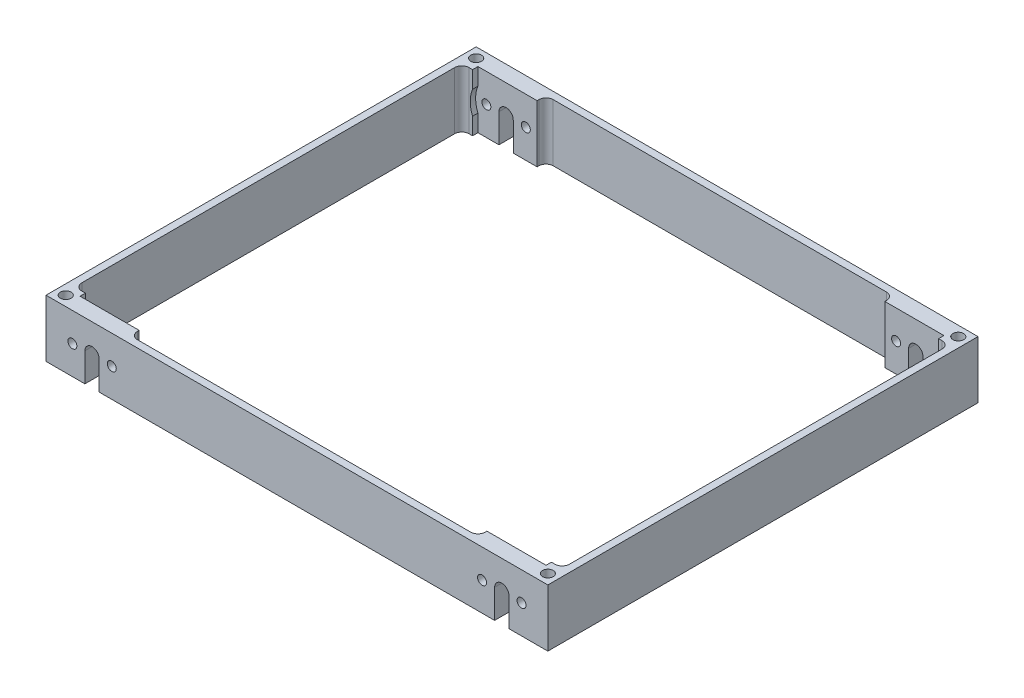
from build123d import *

# Parameters (mm, degrees)
SKETCH1_W           = 140
SKETCH1_H           = 120
SKETCH1_W_2         = 131
SKETCH1_H_2         = 111
BOSS_EXTRUDE1_DEPTH = 16
CUT_EXTRUDE1_DEPTH  = 186.08376482
SKETCH5_R           = 1.25
CUT_EXTRUDE3_DEPTH  = 186.08376482
CUT_EXTRUDE2_DEPTH  = 186.08376482
BOSS_EXTRUDE2_DEPTH = 115.5
SKETCH7_W           = 136
SKETCH7_H           = 108
CUT_EXTRUDE4_DEPTH  = 186.08376482
FILLET1_R           = 2
SKETCH9_R           = 1.3
CUT_EXTRUDE5_DEPTH  = 4
SKETCH10_R          = 1.5
CUT_EXTRUDE6_DEPTH  = 186.08376482


with BuildPart() as part:
    # Sketch1 → Boss-Extrude1 (new body)
    with BuildSketch(Plane(origin=(0, 0, 0), x_dir=(1, 0, 0), z_dir=(0, 1, 0))):
        with Locations((-70, 60)):
            Rectangle(SKETCH1_W, SKETCH1_H)
        with Locations((-70, 60)):
            Rectangle(SKETCH1_W_2, SKETCH1_H_2, mode=Mode.SUBTRACT)
    extrude(amount=BOSS_EXTRUDE1_DEPTH)

    # Sketch3 → Cut-Extrude1 (cut, through all)
    with BuildSketch(Plane.XY):
        with BuildLine():
            Line((-129.15, 8), (-129.15, 0))
            Line((-129.15, 0), (-125.15, 0))
            Line((-125.15, 0), (-125.15, 8))
            ThreePointArc((-125.15, 8), (-127.15, 10), (-129.15, 8))
        make_face()
        with BuildLine():
            Line((-14.85, 8), (-14.85, 0))
            Line((-14.85, 0), (-10.85, 0))
            Line((-10.85, 0), (-10.85, 8))
            ThreePointArc((-10.85, 8), (-12.85, 10), (-14.85, 8))
        make_face()
    extrude(amount=-CUT_EXTRUDE1_DEPTH, mode=Mode.SUBTRACT)

    # Sketch5 → Cut-Extrude3 (cut, through all)
    with BuildSketch(Plane.XY):
        with Locations((-132.65, 8)):
            Circle(SKETCH5_R)
        with Locations((-121.65, 8)):
            Circle(SKETCH5_R)
        with Locations((-18.35, 8)):
            Circle(SKETCH5_R)
        with Locations((-7.35, 8)):
            Circle(SKETCH5_R)
    extrude(amount=-CUT_EXTRUDE3_DEPTH, mode=Mode.SUBTRACT)

    # Sketch4 → Cut-Extrude2 (cut, through all)
    with BuildSketch(Plane(origin=(0, 16, 0), x_dir=(1, 0, 0), z_dir=(0, 1, 0))):
        Polygon((-138, 115.5), (-118.5, 115.5), (-118.5, 118), (-21.5, 118), (-21.5, 115.5), (-2, 115.5), (-2, 4.5), (-21.5, 4.5), (-21.5, 2), (-118.5, 2), (-118.5, 4.5), (-138, 4.5), align=None)
    extrude(amount=-CUT_EXTRUDE2_DEPTH, mode=Mode.SUBTRACT)

    # Sketch6 → Boss-Extrude2 (add)
    with BuildSketch(Plane.XY):
        with BuildLine():
            Line((-140, 16), (-135, 16))
            Line((-135, 16), (-135, 11.259984663))
            ThreePointArc((-135, 11.259984663), (-135.65, 8), (-135, 4.740015337))
            Line((-135, 4.740015337), (-135, 0))
            Line((-135, 0), (-140, 0))
            Line((-140, 0), (-140, 16))
        make_face()
        with BuildLine():
            Line((-5, 16), (-5, 11.259984663))
            ThreePointArc((-5, 11.259984663), (-4.35, 8), (-5, 4.740015337))
            Line((-5, 4.740015337), (-5, 0))
            Line((-5, 0), (0, 0))
            Line((0, 0), (0, 16))
            Line((0, 16), (-5, 16))
        make_face()
    extrude(amount=-BOSS_EXTRUDE2_DEPTH)

    # Sketch7 → Cut-Extrude4 (cut, through all)
    with BuildSketch(Plane(origin=(0, 16, 0), x_dir=(1, 0, 0), z_dir=(0, 1, 0))):
        with Locations((-70, 60)):
            Rectangle(SKETCH7_W, SKETCH7_H)
    extrude(amount=-CUT_EXTRUDE4_DEPTH, mode=Mode.SUBTRACT)

    # Fillet1
    fillet1_edges = [part.edges().sort_by_distance(p)[0] for p in [
        (-118.5, 8, -118),
        (-21.5, 8, -118),
        (-21.5, 8, -2),
        (-118.5, 8, -2),
        (-2, 8, -6),
        (-138, 8, -6),
        (-138, 8, -114),
        (-2, 8, -114),
    ]]
    fillet(fillet1_edges, radius=FILLET1_R)

    # Sketch9 → Cut-Extrude5 (cut)
    with BuildSketch(Plane(origin=(0, 0, 0), x_dir=(1, 0, 0), z_dir=(0, 1, 0))):
        with Locations(Location((-137.25, 2.75, 0), (0, 0, 270))):
            Circle(SKETCH9_R)
        with Locations(Location((-2.75, 2.75, 0), (0, 0, 90))):
            Circle(SKETCH9_R)
        with Locations(Location((-2.75, 117.25, 0), (0, 0, 270))):
            Circle(SKETCH9_R)
        with Locations(Location((-137.25, 117.25, 0), (0, 0, 90))):
            Circle(SKETCH9_R)
    extrude(amount=CUT_EXTRUDE5_DEPTH, mode=Mode.SUBTRACT)

    # Sketch10 → Cut-Extrude6 (cut, through all)
    with BuildSketch(Plane(origin=(0, 16, 0), x_dir=(1, 0, 0), z_dir=(0, 1, 0))):
        with Locations(Location((-137.25, 117.25, 0), (0, 0, 270))):
            Circle(SKETCH10_R)
        with Locations(Location((-2.75, 117.25, 0), (0, 0, 90))):
            Circle(SKETCH10_R)
        with Locations(Location((-2.75, 2.75, 0), (0, 0, 270))):
            Circle(SKETCH10_R)
        with Locations(Location((-137.25, 2.75, 0), (0, 0, 90))):
            Circle(SKETCH10_R)
    extrude(amount=-CUT_EXTRUDE6_DEPTH, mode=Mode.SUBTRACT)


solid = part.part
